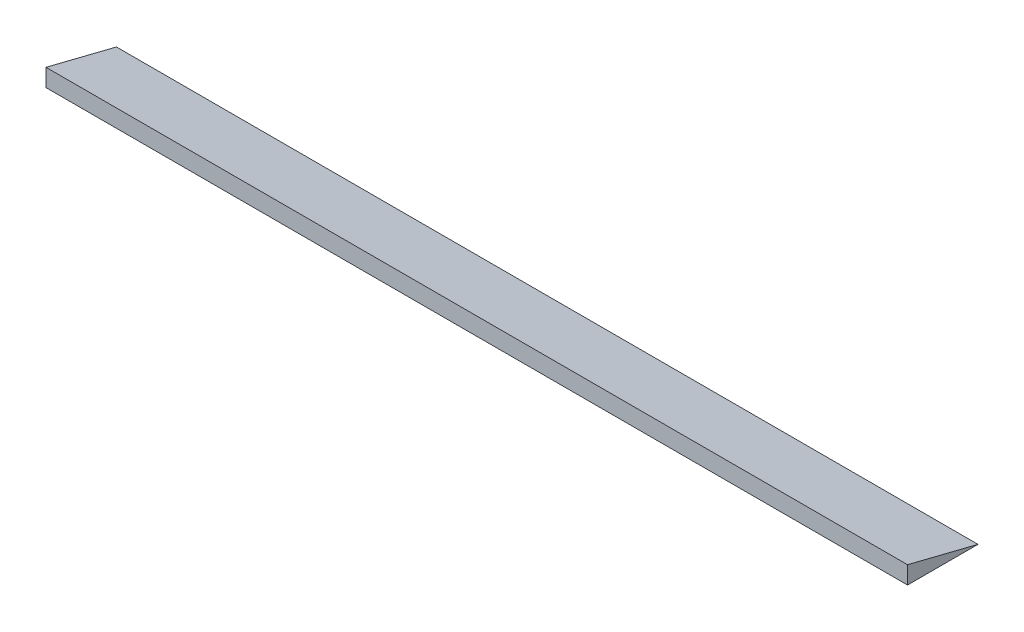
from build123d import *

# Parameters (mm, degrees)
BOSS_EXTRUDE1_DEPTH = 310.5


with BuildPart() as part:
    # Sketch1 → Boss-Extrude1 (new, symmetric)
    with BuildSketch(Plane(origin=(0, 0, 0), x_dir=(0, 0, -1), z_dir=(1, 0, 0))):
        Polygon((0, 0), (0, -12.7), (50.8, -12.7), align=None)
    extrude(amount=BOSS_EXTRUDE1_DEPTH, both=True)


solid = part.part
